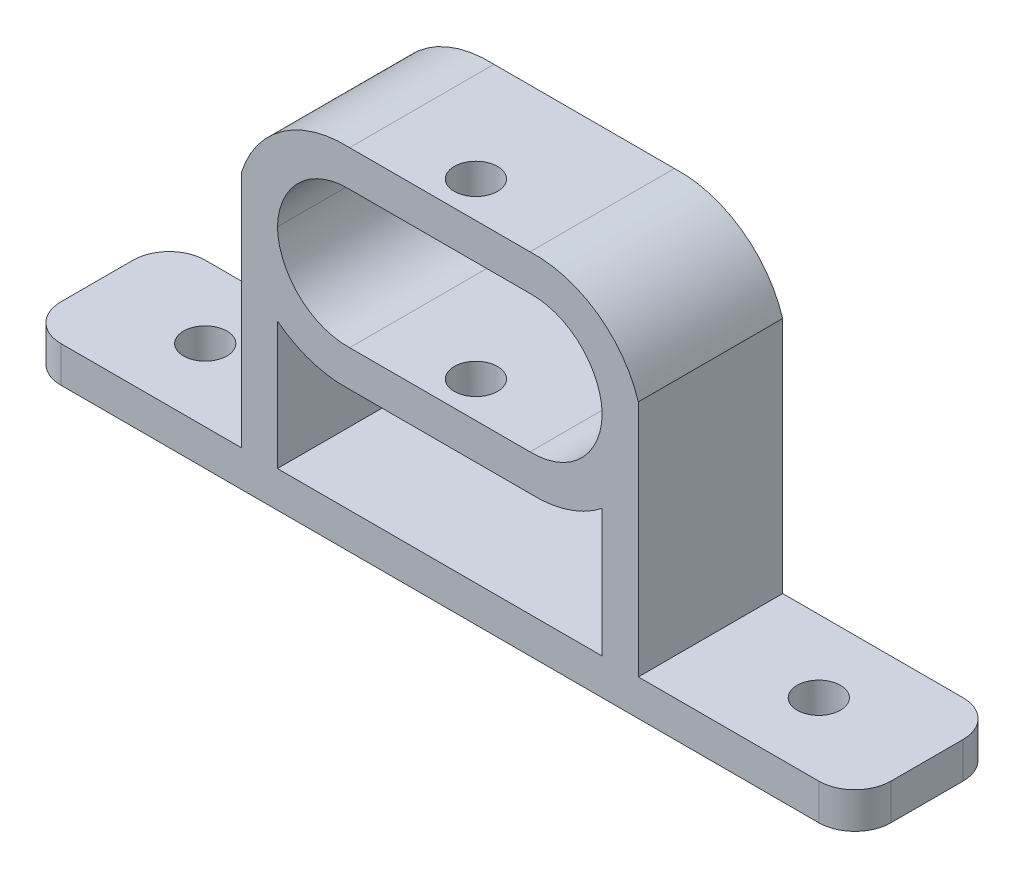
from build123d import *

# Parameters (mm, degrees)
SALIENTE_EXTRUIR1_DEPTH = 20
SALIENTE_EXTRUIR2_DEPTH = 20
CORTAR_EXTRUIR2_REACH   = 89.477
CROQUIS4_R              = 3
REDONDEO1_R             = 5
CORTAR_EXTRUIR3_REACH   = 86.815
CROQUIS5_R              = 3


with BuildPart() as part:
    # Croquis1 → Saliente-Extruir1 (new body)
    with BuildSketch(Plane.XY):
        with BuildLine():
            Line((0, -20.75), (25, -20.75))
            ThreePointArc((25, -20.75), (34.287921033, -18.054172905), (40, -10.25))
            Line((40, -10.25), (40, -6.25))
            Line((40, -6.25), (40, -2.25))
            ThreePointArc((40, -2.25), (34.287921033, 5.554172905), (25, 8.25))
            Line((25, 8.25), (0, 8.25))
            ThreePointArc((0, 8.25), (-9.287921033, 5.554172905), (-15, -2.25))
            Line((-15, -2.25), (-15, -6.25))
            Line((-15, -6.25), (-15, -10.25))
            ThreePointArc((-15, -10.25), (-9.287921033, -18.054172905), (0, -20.75))
        make_face()
        with BuildLine():
            Line((0, 3.25), (25, 3.25))
            ThreePointArc((25, 3.25), (31.967514421, 0.571067812), (35, -6.25))
            ThreePointArc((35, -6.25), (31.967514421, -13.071067812), (25, -15.75))
            Line((25, -15.75), (0, -15.75))
            ThreePointArc((0, -15.75), (-6.967514421, -13.071067812), (-10, -6.25))
            ThreePointArc((-10, -6.25), (-6.967514421, 0.571067812), (0, 3.25))
        make_face(mode=Mode.SUBTRACT)
    extrude(amount=SALIENTE_EXTRUIR1_DEPTH)

    # Croquis3 → Saliente-Extruir2 (add, through all)
    with BuildSketch(Plane.XY.offset(20)):
        with BuildLine():
            Line((40, -10.25), (40, -35.25))
            Line((40, -35.25), (70, -35.25))
            Line((70, -35.25), (70, -40.25))
            Line((70, -40.25), (40, -40.25))
            Line((40, -40.25), (-15, -40.25))
            Line((-15, -40.25), (-45, -40.25))
            Line((-45, -40.25), (-45, -35.25))
            Line((-45, -35.25), (-15, -35.25))
            Line((-15, -35.25), (-15, -10.25))
            ThreePointArc((-15, -10.25), (-13.047109047, -14.26290739), (-10, -17.523633574))
            Line((-10, -17.523633574), (-10, -35.25))
            Line((-10, -35.25), (35, -35.25))
            Line((35, -35.25), (35, -17.523633574))
            ThreePointArc((35, -17.523633574), (38.047109047, -14.26290739), (40, -10.25))
        make_face()
    extrude(amount=-SALIENTE_EXTRUIR2_DEPTH)

    # Cortar-Extruir2: up to this face of the body (flat: up to its plane)
    cortar_extruir2_end = Plane(part.part.faces().sort_by_distance((12.5, -20.75, 10))[0])
    # Croquis4 → Cortar-Extruir2 (cut, up to the picked face)
    with BuildSketch(Plane(origin=(0, 8.25, 0), x_dir=(1, 0, 0), z_dir=(0, 1, 0)), mode=Mode.PRIVATE) as cortar_extruir2_sk1:
        with Locations(Location((12.5, -15, 0), (0, 0, 270))):
            Circle(CROQUIS4_R)
    cortar_extruir2_tool1 = split(extrude(cortar_extruir2_sk1.sketch, amount=-CORTAR_EXTRUIR2_REACH, mode=Mode.PRIVATE), bisect_by=cortar_extruir2_end, keep=Keep.BOTH, mode=Mode.PRIVATE)
    add(cortar_extruir2_tool1.solids().sort_by(Axis((12.5, 8.25, 15), (0, -1, 0)))[0], mode=Mode.SUBTRACT)

    # Redondeo1
    redondeo1_edges = [part.edges().sort_by_distance(p)[0] for p in [
        (70, -37.75, 0),
        (-45, -37.75, 0),
        (-45, -37.75, 20),
        (70, -37.75, 20),
    ]]
    fillet(redondeo1_edges, radius=REDONDEO1_R)

    # Croquis5 → Cortar-Extruir3 (cut, up to next)
    with BuildSketch(Plane(origin=(0, -35.25, 0), x_dir=(1, 0, 0), z_dir=(0, 1, 0)), mode=Mode.PRIVATE) as cortar_extruir3_sk1:
        with Locations(Location((-30, -10, 0), (0, 0, 180))):
            Circle(CROQUIS5_R)
    cortar_extruir3_tool1 = extrude(cortar_extruir3_sk1.sketch, amount=-CORTAR_EXTRUIR3_REACH, mode=Mode.PRIVATE) & part.part
    # Croquis5 → Cortar-Extruir3 (cut, up to next)
    with BuildSketch(Plane(origin=(0, -35.25, 0), x_dir=(1, 0, 0), z_dir=(0, 1, 0)), mode=Mode.PRIVATE) as cortar_extruir3_sk2:
        with Locations(Location((55, -10, 0), (0, 0, 90))):
            Circle(CROQUIS5_R)
    cortar_extruir3_tool2 = extrude(cortar_extruir3_sk2.sketch, amount=-CORTAR_EXTRUIR3_REACH, mode=Mode.PRIVATE) & part.part
    add(cortar_extruir3_tool1.solids().sort_by_distance((-30, -35.25, 10))[0], mode=Mode.SUBTRACT)
    add(cortar_extruir3_tool2.solids().sort_by_distance((55, -35.25, 10))[0], mode=Mode.SUBTRACT)


solid = part.part
